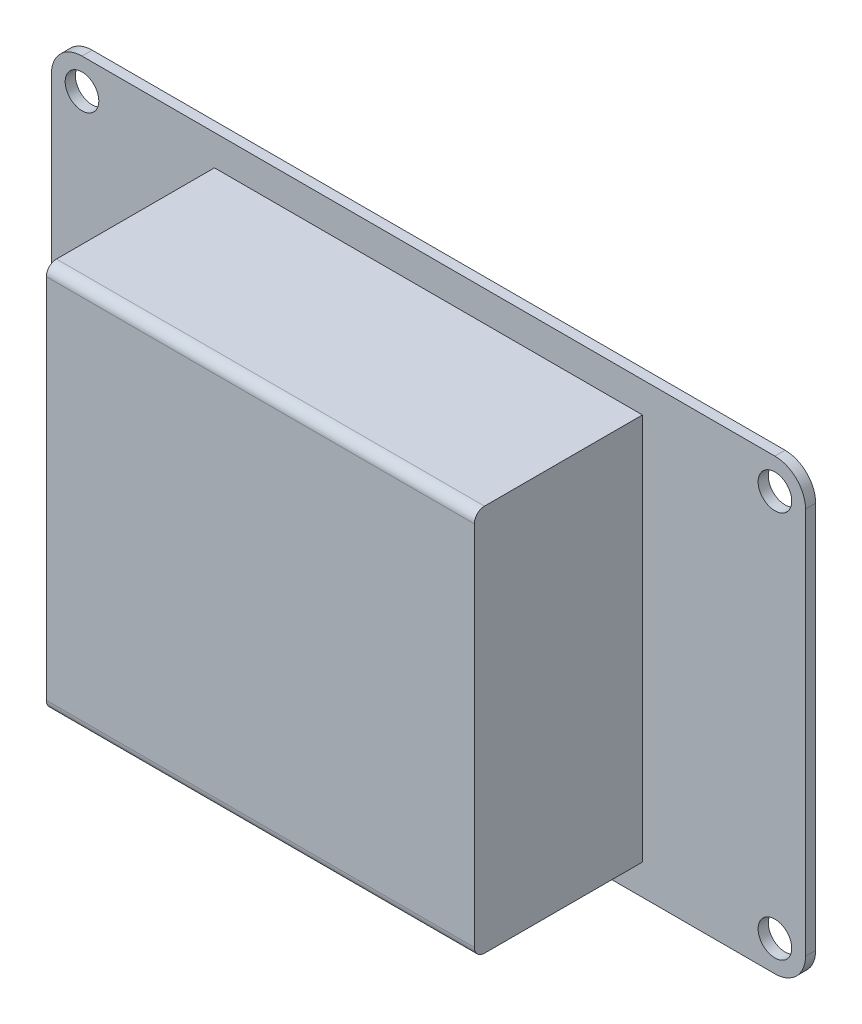
from build123d import *

# Parameters (mm, degrees)
CROQUIS1_R              = 1.65
SALIENTE_EXTRUIR1_DEPTH = 1
CROQUIS3_W              = 42
CROQUIS3_H              = 38
SALIENTE_EXTRUIR2_DEPTH = 16.5
REDONDEO1_R             = 1


with BuildPart() as part:
    # Croquis1 → Saliente-Extruir1 (new body)
    with BuildSketch(Plane(origin=(0, 0, 0), x_dir=(0, 1, 0), z_dir=(0, 0, 1))):
        with BuildLine():
            Line((-19, -37), (19, -37))
            ThreePointArc((19, -37), (21.121320344, -36.121320344), (22, -34))
            Line((22, -34), (22, 34))
            ThreePointArc((22, 34), (21.121320344, 36.121320344), (19, 37))
            Line((19, 37), (-19, 37))
            ThreePointArc((-19, 37), (-21.121320344, 36.121320344), (-22, 34))
            Line((-22, 34), (-22, -34))
            ThreePointArc((-22, -34), (-21.121320344, -36.121320344), (-19, -37))
        make_face()
        with Locations(Location((-19, 34, 0), (0, 0, 270))):
            Circle(CROQUIS1_R, mode=Mode.SUBTRACT)
        with Locations(Location((19, 34, 0), (0, 0, 270))):
            Circle(CROQUIS1_R, mode=Mode.SUBTRACT)
        with Locations(Location((19, -34, 0), (0, 0, 270))):
            Circle(CROQUIS1_R, mode=Mode.SUBTRACT)
        with Locations(Location((-19, -34, 0), (0, 0, 270))):
            Circle(CROQUIS1_R, mode=Mode.SUBTRACT)
    extrude(amount=SALIENTE_EXTRUIR1_DEPTH)

    # Croquis3 → Saliente-Extruir2 (add)
    with BuildSketch(Plane.XY.offset(1)):
        Rectangle(CROQUIS3_W, CROQUIS3_H)
    extrude(amount=SALIENTE_EXTRUIR2_DEPTH)

    # Redondeo1
    redondeo1_edges = [part.edges().sort_by_distance(p)[0] for p in [
        (0, 19, 17.5),
        (0, -19, 17.5),
    ]]
    fillet(redondeo1_edges, radius=REDONDEO1_R)


solid = part.part
